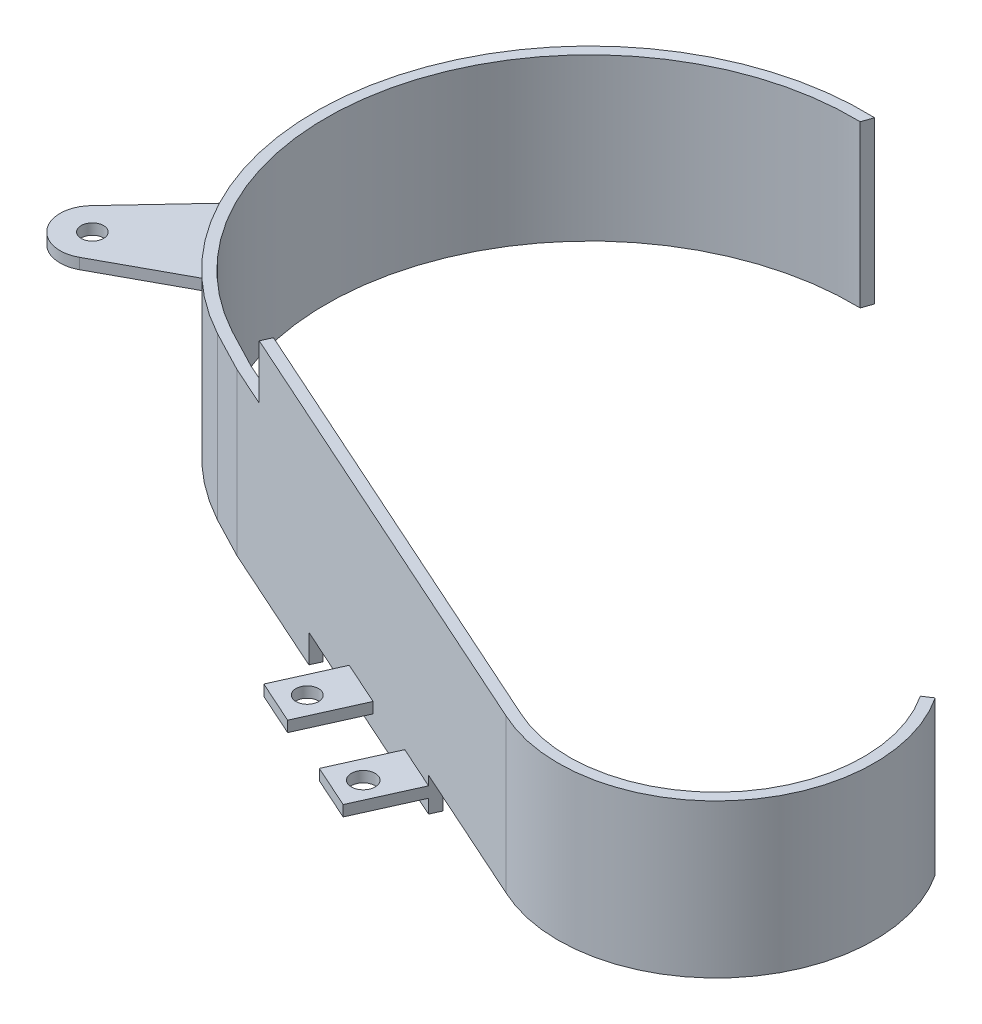
from build123d import *

# Parameters (mm, degrees)
BOSS_EXTRUDE1_DEPTH      = 25.4
BOSS_EXTRUDE1_DEPTH_BACK = 38.1
SKETCH8_W                = 123.535434654
SKETCH8_H                = 17.820393788
SKETCH8_W_2              = 107.648650008
SKETCH8_H_2              = 18.69081023
SKETCH8_W_3              = 70.279057637
SKETCH8_H_3              = 8.745584685
CUT_EXTRUDE8_DEPTH       = 249.85459317
SKETCH9_W                = 13.97
SKETCH9_H                = 3.175
BOSS_EXTRUDE2_DEPTH      = 19.05
SKETCH10_R               = 3.5
SKETCH10_R_2             = 3.33435983
CUT_EXTRUDE9_DEPTH       = 193.549453602
SKETCH11_R               = 3.3
BOSS_EXTRUDE3_DEPTH      = 3.175


with BuildPart() as part:
    # Sketch1 → Boss-Extrude1 (new, two sides: drawn at the far end of the back side and taken through both)
    with BuildSketch(Plane(origin=(0, 0, 0), x_dir=(1, 0, 0), z_dir=(0, 1, 0)).offset(-BOSS_EXTRUDE1_DEPTH_BACK)):
        with BuildLine():
            Line((75.173258544, -98.513613558), (-56.782466528, -39.220463143))
            Line((-56.782466528, -39.220463143), (-69.080642984, -33.693819057))
            Line((-69.080642984, -33.693819057), (-80.694369412, -27.627832989))
            ThreePointArc((-80.694369412, -27.627832989), (-118.690304786, 60.820348405), (-41.597550485, 118.469972265))
            Line((-41.597550485, 118.469972265), (-40.510743974, 121.612378267))
            ThreePointArc((-40.510743974, 121.612378267), (-121.611751141, 62.177923058), (-82.302619901, -30.367309292))
            Line((-82.302619901, -30.367309292), (-70.352378469, -36.603743496))
            Line((-70.352378469, -36.603743496), (73.849161484, -101.399443673))
            ThreePointArc((73.849161484, -101.399443673), (128.866936987, -89.667676037), (132.52114904, -33.531798673))
            Line((132.52114904, -33.531798673), (129.87034504, -35.279329261))
            ThreePointArc((129.87034504, -35.279329261), (126.457174239, -87.60035304), (75.173258544, -98.513613558))
        make_face()
    extrude(amount=BOSS_EXTRUDE1_DEPTH + BOSS_EXTRUDE1_DEPTH_BACK)

    # Sketch8 → Cut-Extrude8 (cut, through all)
    with BuildSketch(Plane(origin=(-26.544057216, 0, 59.073270551), x_dir=(0.9121462285238172, 0, 0.4098649262742256), z_dir=(-0.4098649262742256, 0, 0.9121462285238172))):
        with Locations((-97.740996954, 18.372591372)):
            Rectangle(SKETCH8_W, SKETCH8_H)
        with Locations((117.247557269, -29.159427294)):
            Rectangle(SKETCH8_W_2, SKETCH8_H_2)
        with Locations((28.283703447, -34.132040067)):
            Rectangle(SKETCH8_W_3, SKETCH8_H_3)
    extrude(amount=-CUT_EXTRUDE8_DEPTH, mode=Mode.SUBTRACT)

    # Sketch9 → Boss-Extrude2 (add)
    with BuildSketch(Plane(origin=(-25.503000303, 0, 56.756419131), x_dir=(0.9121462285238173, 0, 0.40986492627422544), z_dir=(-0.40986492627422544, 0, 0.9121462285238173))):
        with Locations((56.438232265, -24.112299079)):
            Rectangle(SKETCH9_W, SKETCH9_H)
        with Locations((23.842597685, -24.112299079)):
            Rectangle(SKETCH9_W, SKETCH9_H)
    extrude(amount=BOSS_EXTRUDE2_DEPTH)

    # Sketch10 → Cut-Extrude9 (cut, through all)
    with BuildSketch(Plane(origin=(0, -25.699799079, 0), x_dir=(-1, 0, 0), z_dir=(0, -1, 0))):
        with Locations(Location((-21.260331788, -90.924752525, 0), (0, 0, 180))):
            Circle(SKETCH10_R)
        with Locations(Location((8.708938333, -77.458323235, 0), (0, 0, 180))):
            Circle(SKETCH10_R_2)
    extrude(amount=-CUT_EXTRUDE9_DEPTH, mode=Mode.SUBTRACT)

    # Sketch11 → Boss-Extrude3 (add)
    with BuildSketch(Plane(origin=(0, 2.365700518, 0), x_dir=(1, 0, 0), z_dir=(0, 1, 0))):
        with BuildLine():
            Line((-137.515282661, -12.448119592), (-117.841020701, 8.538369727))
            ThreePointArc((-117.841020701, 8.538369727), (-111.239130232, -3.699946448), (-102.640289142, -14.627950496))
            Line((-102.640289142, -14.627950496), (-126.018526364, -27.331725219))
            ThreePointArc((-126.018526364, -27.331725219), (-138.10436789, -24.785259853), (-137.515282661, -12.448119592))
        make_face()
        with Locations(Location((-130.566346327, -18.962558081, 0), (0, 0, 180))):
            Circle(SKETCH11_R, mode=Mode.SUBTRACT)
    extrude(amount=BOSS_EXTRUDE3_DEPTH)


solid = part.part
